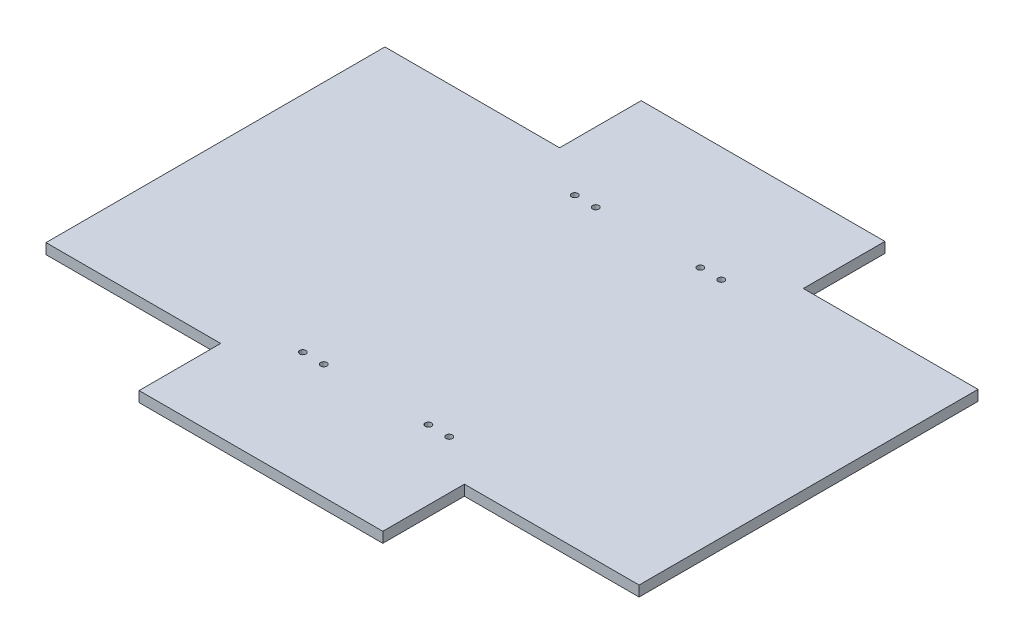
from build123d import *

# Parameters (mm, degrees)
BOSS_EXTRUDE1_DEPTH     = 5
CUT_EXTRUDE1_DEPTH      = 0.1
CUT_EXTRUDE2_DEPTH      = 194.597682063
CUT_EXTRUDE2_DEPTH_BACK = 194.597682063
SKETCH3_W               = 6
SKETCH3_H               = 162
SKETCH3_W_2             = 116.5
SKETCH3_H_2             = 5
CUT_EXTRUDE4_DEPTH      = 186.790372463
CUT_EXTRUDE4_DEPTH_BACK = 186.790372463
SKETCH7_R               = 1.5


with BuildPart() as part:
    # Sketch1 → Boss-Extrude1 (new body)
    with BuildSketch(Plane(origin=(0, 0, 0), x_dir=(1, 0, 0), z_dir=(0, 1, 0))):
        Polygon((-58.25, 125), (58.25, 125), (58.25, 81), (147.75, 81), (147.75, -81), (58.25, -81), (58.25, -125), (-58.25, -125), (-58.25, -81), (-147.75, -81), (-147.75, 81), (-58.25, 81), align=None)
    extrude(amount=BOSS_EXTRUDE1_DEPTH)

    # Sketch2 → Cut-Extrude1 (cut)
    with BuildSketch(Plane.XZ):
        Polygon((-103, 65), (-82.5, 65), (-82.5, 70), (-123.5, 70), (-123.5, 65), align=None)
        Polygon((123.5, 70), (123.5, 65), (103, 65), (82.5, 65), (82.5, 70), align=None)
        Polygon((-123.5, -70), (-123.5, -65), (-103, -65), (-82.5, -65), (-82.5, -70), align=None)
        Polygon((82.5, -70), (123.5, -70), (123.5, -65), (103, -65), (82.5, -65), align=None)
    extrude(amount=-CUT_EXTRUDE1_DEPTH, mode=Mode.SUBTRACT)

    # Sketch3 → Cut-Extrude2 (cut, two sides: drawn at the far end of the back side and taken through both)
    with BuildSketch(Plane(origin=(0, 5, 0), x_dir=(1, 0, 0), z_dir=(0, 1, 0)).offset(-CUT_EXTRUDE2_DEPTH_BACK)):
        with Locations((-144.75, 0)):
            Rectangle(SKETCH3_W, SKETCH3_H)
        with Locations((144.75, 0)):
            Rectangle(SKETCH3_W, SKETCH3_H)
        with Locations((0, 122.5)):
            Rectangle(SKETCH3_W_2, SKETCH3_H_2)
        with Locations((0, -122.5)):
            Rectangle(SKETCH3_W_2, SKETCH3_H_2)
    extrude(amount=CUT_EXTRUDE2_DEPTH + CUT_EXTRUDE2_DEPTH_BACK, mode=Mode.SUBTRACT)

    # Sketch7 → Cut-Extrude4 (cut, two sides: drawn at the far end of the back side and taken through both)
    with BuildSketch(Plane(origin=(0, 5, 0), x_dir=(1, 0, 0), z_dir=(0, 1, 0)).offset(-CUT_EXTRUDE4_DEPTH_BACK)):
        with Locations(Location((25, -65, 0), (0, 0, 270))):
            Circle(SKETCH7_R)
        with Locations(Location((35, -65, 0), (0, 0, 90))):
            Circle(SKETCH7_R)
        with Locations(Location((-35, -65, 0), (0, 0, 270))):
            Circle(SKETCH7_R)
        with Locations(Location((-25, -65, 0), (0, 0, 90))):
            Circle(SKETCH7_R)
        with Locations(Location((-25, 65, 0), (0, 0, 270))):
            Circle(SKETCH7_R)
        with Locations(Location((-35, 65, 0), (0, 0, 90))):
            Circle(SKETCH7_R)
        with Locations(Location((35, 65, 0), (0, 0, 270))):
            Circle(SKETCH7_R)
        with Locations(Location((25, 65, 0), (0, 0, 90))):
            Circle(SKETCH7_R)
    extrude(amount=CUT_EXTRUDE4_DEPTH + CUT_EXTRUDE4_DEPTH_BACK, mode=Mode.SUBTRACT)


solid = part.part
